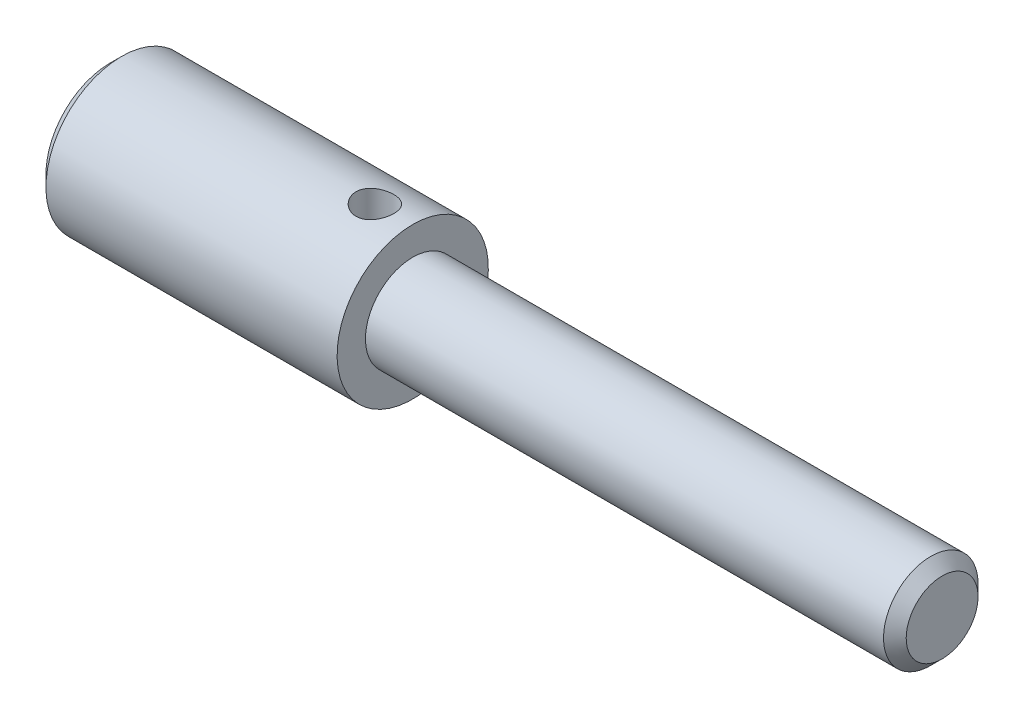
from build123d import *

# Parameters (mm, degrees)
CHAMFER_1_SIZE           = 0.6
CUT_EXTRUDE_1_REACH      = 46.9
CUT_EXTRUDE_1_END_RADIUS = 4
SKETCH_2_R               = 1


with BuildPart() as part:
    # Эскиз1 → Повернуть1 (revolve)
    with BuildSketch(Plane.XY):
        Polygon((0, 0), (16, 0), (16, -1.5), (44, -1.5), (44, -4), (0, -4), align=None)
    revolve(axis=Axis((44, -4, 0), (-1, 0, 0)))

    # Фаска1
    chamfer_1_edges = [part.edges().sort_by_distance(p)[0] for p in [
        (44, -6.5, 0),
        (0, -8, 0),
    ]]
    chamfer(chamfer_1_edges, length=CHAMFER_1_SIZE)

    # Вырез-Вытянуть1: up to this cylinder (the profile starts inside it)
    cut_extrude_1_end = Plane(origin=(14, -4, 0), z_dir=(1, 0, 0)) * Cylinder(CUT_EXTRUDE_1_END_RADIUS, 102.8, mode=Mode.PRIVATE)
    # Эскиз2 → Вырез-Вытянуть1 (cut, up to the surface)
    with BuildSketch(Plane(origin=(0, 0, 0), x_dir=(1, 0, 0), z_dir=(0, 1, 0)), mode=Mode.PRIVATE) as cut_extrude_1_sk1:
        with Locations(Location((14, 0, 0), (0, 0, 270))):
            Circle(SKETCH_2_R)
    cut_extrude_1_tool1 = extrude(cut_extrude_1_sk1.sketch, amount=-CUT_EXTRUDE_1_REACH, mode=Mode.PRIVATE) & cut_extrude_1_end
    add(cut_extrude_1_tool1.solids().sort_by_distance((14, 0, 0))[0], mode=Mode.SUBTRACT)


solid = part.part
